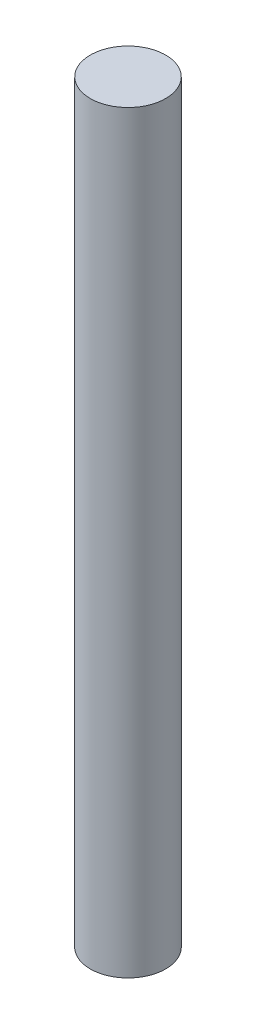
from build123d import *

# Parameters (mm, degrees)
SKETCH_1_R      = 5
EXTRUDE_1_DEPTH = 100


with BuildPart() as part:
    # 草图1 → 凸台-拉伸1 (new body)
    with BuildSketch(Plane(origin=(0, 0, 0), x_dir=(1, 0, 0), z_dir=(0, 1, 0))):
        with Locations(Location((0, 0, 0), (0, 0, 270))):
            Circle(SKETCH_1_R)
    extrude(amount=EXTRUDE_1_DEPTH)


solid = part.part
